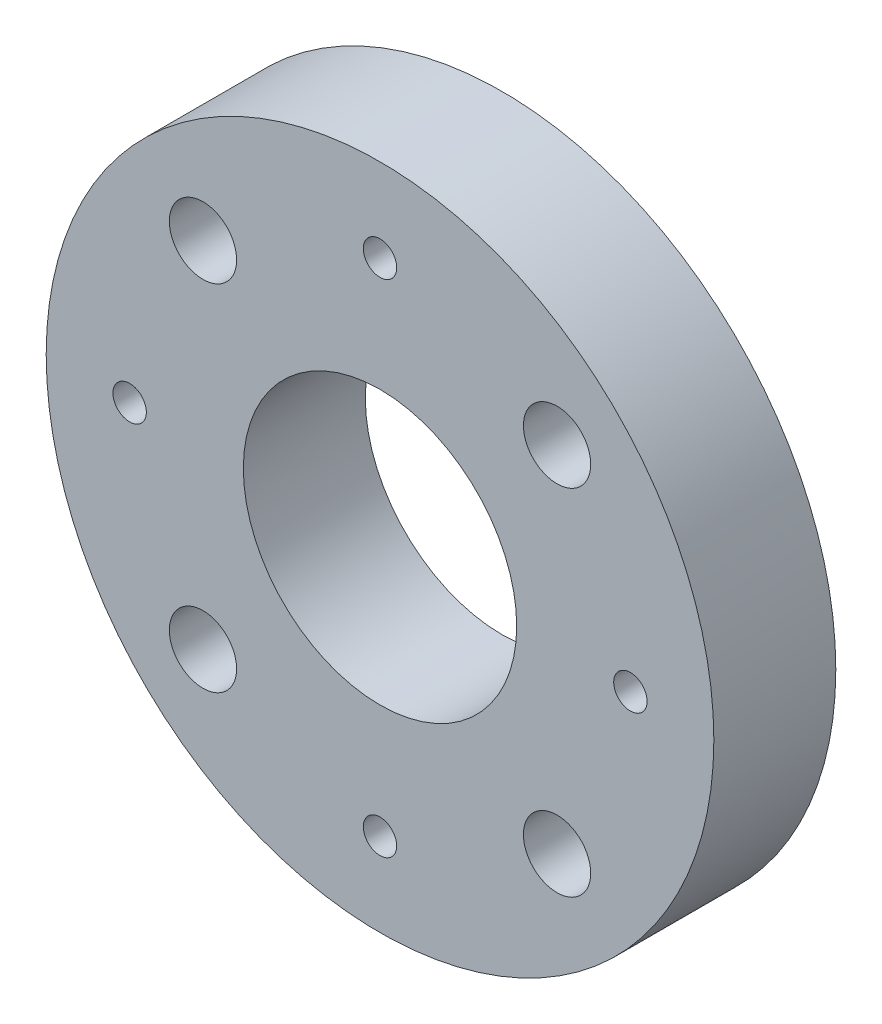
from build123d import *

# Parameters (mm, degrees)
SKETCH1_R                = 15.875
SKETCH1_R_2              = 6.5
SKETCH1_R_3              = 0.79375
BOSS_EXTRUDE1_DEPTH      = 5.8
M3_CLEARANCE_HOLE1_D     = 3.2
M3_CLEARANCE_HOLE1_DEPTH = 5.8
M3_CLEARANCE_HOLE1_TIP   = 0.96137699


with BuildPart() as part:
    # Sketch1 → Boss-Extrude1 (new body)
    with BuildSketch(Plane.XY):
        Circle(SKETCH1_R)
        Circle(SKETCH1_R_2, mode=Mode.SUBTRACT)
        with Locations((0, 11.90625)):
            Circle(SKETCH1_R_3, mode=Mode.SUBTRACT)
        with Locations((-11.90625, 0)):
            Circle(SKETCH1_R_3, mode=Mode.SUBTRACT)
        with Locations((0, -11.90625)):
            Circle(SKETCH1_R_3, mode=Mode.SUBTRACT)
        with Locations((11.90625, 0)):
            Circle(SKETCH1_R_3, mode=Mode.SUBTRACT)
    extrude(amount=BOSS_EXTRUDE1_DEPTH)

    # M3 Clearance Hole1
    with Locations(Plane.XY.offset(5.8)):
        with Locations((-8.418990114, 8.418990114), (8.418990114, 8.418990114), (8.418990114, -8.418990114), (-8.418990114, -8.418990114)):
            Hole(M3_CLEARANCE_HOLE1_D / 2, depth=M3_CLEARANCE_HOLE1_DEPTH)
            with Locations((0, 0, -(M3_CLEARANCE_HOLE1_DEPTH + M3_CLEARANCE_HOLE1_TIP / 2))):  # 118° drill point
                Cone(0, M3_CLEARANCE_HOLE1_D / 2, M3_CLEARANCE_HOLE1_TIP, mode=Mode.SUBTRACT)


solid = part.part
